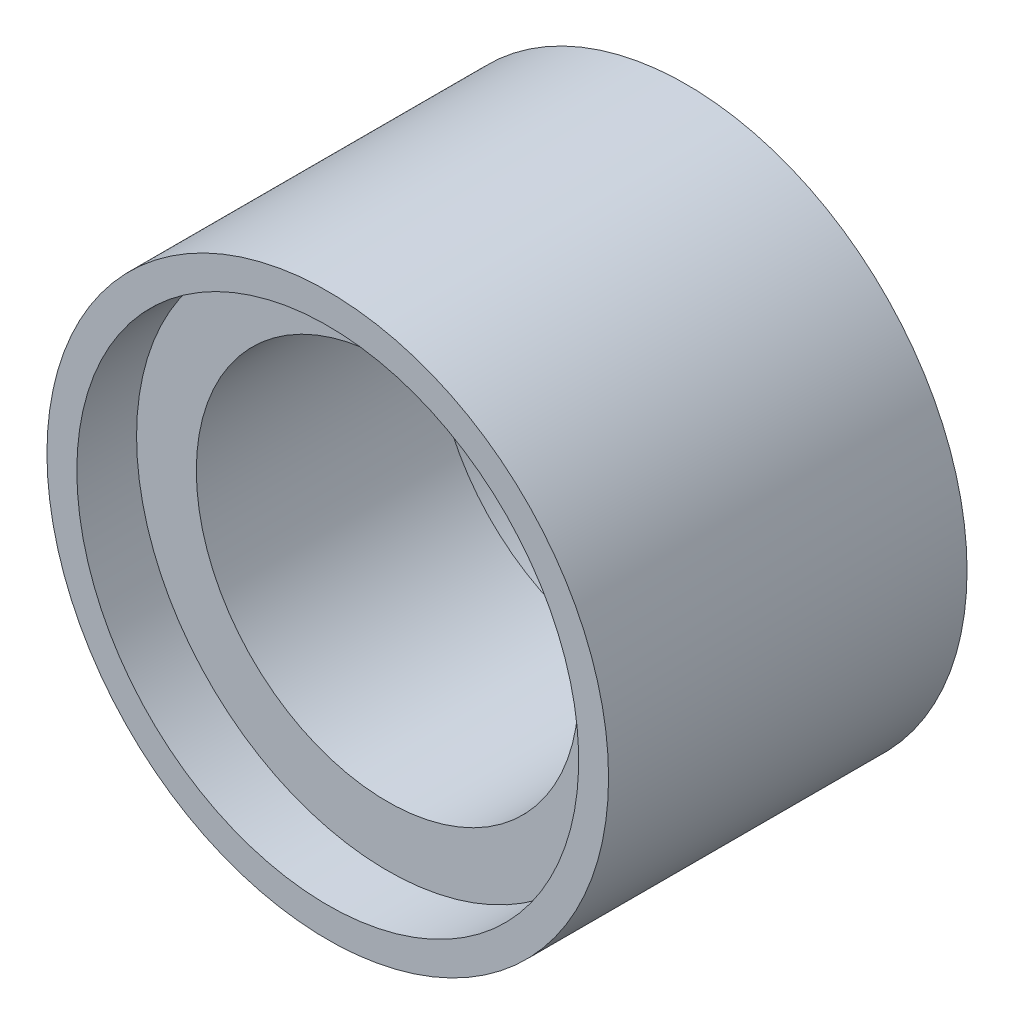
from build123d import *
from build123d.topology import SkipClean

# Parameters (mm, degrees)
SKETCH1_R           = 23.5
SKETCH1_R_2         = 16
BOSS_EXTRUDE1_DEPTH = 10
SKETCH2_R           = 23.5
SKETCH2_R_2         = 21
BOSS_EXTRUDE2_DEPTH = 5


with BuildPart() as part:
    # Sketch1 → Boss-Extrude1 (new, symmetric)
    with BuildSketch(Plane.XY):
        Circle(SKETCH1_R)
        Circle(SKETCH1_R_2, mode=Mode.SUBTRACT)
    extrude(amount=BOSS_EXTRUDE1_DEPTH, both=True)

    # Sketch2 → Boss-Extrude2 (add)
    with BuildSketch(Plane(origin=(0, 0, -10), x_dir=(-1, 0, 0), z_dir=(0, 0, -1))):
        Circle(SKETCH2_R)
        Circle(SKETCH2_R_2, mode=Mode.SUBTRACT)
    boss_extrude2 = extrude(amount=BOSS_EXTRUDE2_DEPTH)

    # Mirror1: Boss-Extrude2 across plane
    with SkipClean():  # the faces are left unmerged after this step: merging them gives an invalid solid
        add(boss_extrude2.mirror(Plane.XY))


solid = part.part
